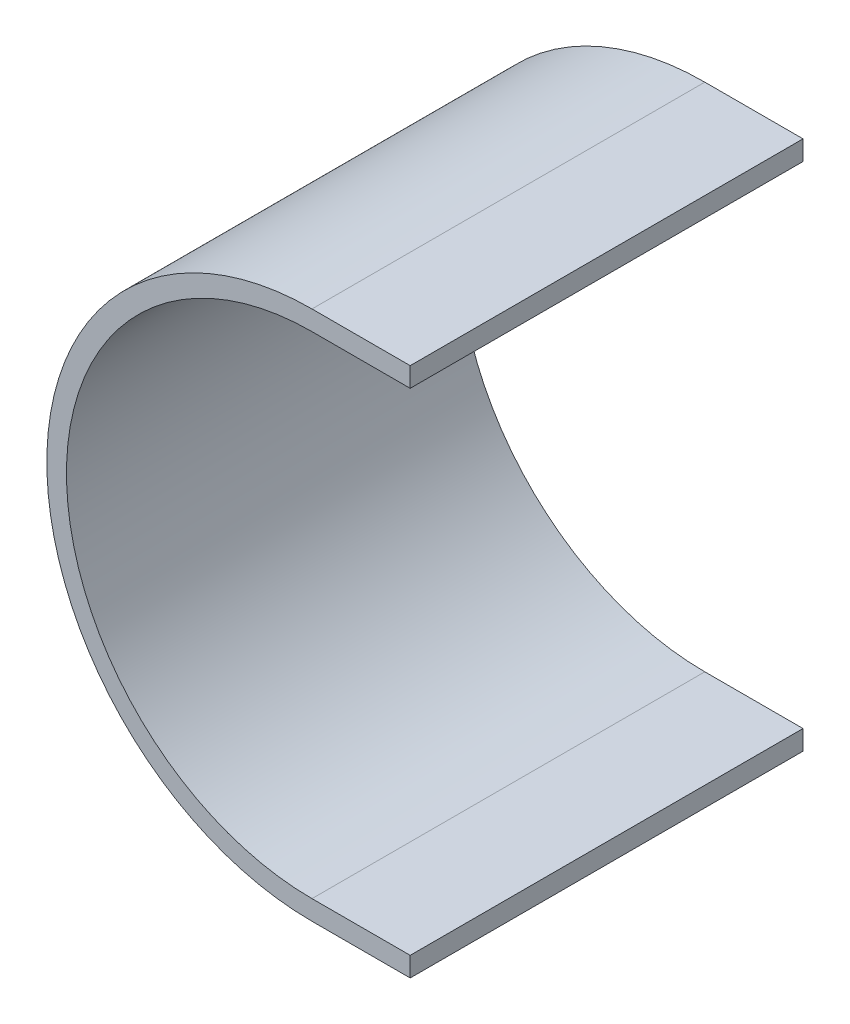
from build123d import *

# Parameters (mm, degrees)
BOSS_EXTRUDE1_DEPTH = 120


with BuildPart() as part:
    # Sketch1 → Boss-Extrude1 (new body)
    with BuildSketch(Plane.XY):
        with BuildLine():
            Line((0, 81), (30, 81))
            Line((30, 81), (30, 75))
            Line((30, 75), (0, 75))
            ThreePointArc((0, 75), (-75, 0), (0, -75))
            Line((0, -75), (30, -75))
            Line((30, -75), (30, -81))
            Line((30, -81), (0, -81))
            ThreePointArc((0, -81), (-81, 0), (0, 81))
        make_face()
    extrude(amount=BOSS_EXTRUDE1_DEPTH)


solid = part.part
